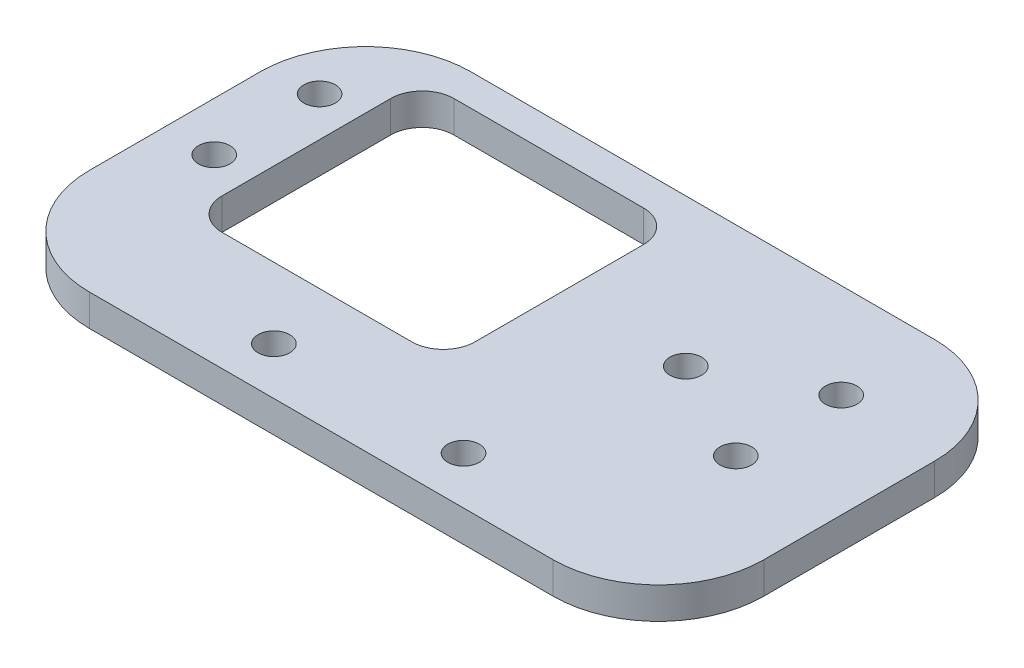
from build123d import *

# Parameters (mm, degrees)
SKETCH_1_W          = 64
SKETCH_1_H          = 36.2
SKETCH_1_R          = 1.5
SKETCH_1_W_2        = 42
SKETCH_1_H_2        = 22
EXTRUDE_1_DEPTH     = 3
SKETCH_2_W          = 18
SKETCH_2_H          = 22
EXTRUDE_2_DEPTH     = 3
SKETCH_3_R          = 1.5
CUT_EXTRUDE_1_DEPTH = 3
FILLET_1_R          = 10
FILLET_2_R          = 3


with BuildPart() as part:
    # 草图1 → 凸台-拉伸1 (new body)
    with BuildSketch(Plane(origin=(0, 0, 0), x_dir=(1, 0, 0), z_dir=(0, 1, 0))):
        Rectangle(SKETCH_1_W, SKETCH_1_H)
        with Locations(Location((22.14, 9.1, 0), (0, 0, 270))):
            Circle(SKETCH_1_R, mode=Mode.SUBTRACT)
        with Locations(Location((22.14, -0.9, 0), (0, 0, 90))):
            Circle(SKETCH_1_R, mode=Mode.SUBTRACT)
        with Locations(Location((-27.36, -0.9, 0), (0, 0, 270))):
            Circle(SKETCH_1_R, mode=Mode.SUBTRACT)
        with Locations(Location((-27.36, 9.1, 0), (0, 0, 90))):
            Circle(SKETCH_1_R, mode=Mode.SUBTRACT)
        with Locations(Location((9, -13.6, 0), (0, 0, 270))):
            Circle(SKETCH_1_R, mode=Mode.SUBTRACT)
        with Locations(Location((-9, -13.6, 0), (0, 0, 90))):
            Circle(SKETCH_1_R, mode=Mode.SUBTRACT)
        with Locations((-2.61, 4.1)):
            Rectangle(SKETCH_1_W_2, SKETCH_1_H_2, mode=Mode.SUBTRACT)
    extrude(amount=EXTRUDE_1_DEPTH)

    # 草图2 → 凸台-拉伸2 (add)
    with BuildSketch(Plane(origin=(0, 3, 0), x_dir=(1, 0, 0), z_dir=(0, 1, 0))):
        with Locations((9.39, 4.1)):
            Rectangle(SKETCH_2_W, SKETCH_2_H)
    extrude(amount=-EXTRUDE_2_DEPTH)

    # 草图3 → 切除-拉伸1 (cut)
    with BuildSketch(Plane(origin=(0, 3, 0), x_dir=(1, 0, 0), z_dir=(0, 1, 0))):
        with Locations(Location((12.39, 4.1, 0), (0, 0, 270))):
            Circle(SKETCH_3_R)
    extrude(amount=-CUT_EXTRUDE_1_DEPTH, mode=Mode.SUBTRACT)

    # 圆角1
    fillet_1_edges = [part.edges().sort_by_distance(p)[0] for p in [
        (32, 1.5, 18.1),
        (-32, 1.5, 18.1),
        (-32, 1.5, -18.1),
        (32, 1.5, -18.1),
    ]]
    fillet(fillet_1_edges, radius=FILLET_1_R)

    # 圆角2
    fillet_2_edges = [part.edges().sort_by_distance(p)[0] for p in [
        (-23.61, 1.5, -15.1),
        (-23.61, 1.5, 6.9),
        (0.39, 1.5, -15.1),
        (0.39, 1.5, 6.9),
    ]]
    fillet(fillet_2_edges, radius=FILLET_2_R)


solid = part.part
